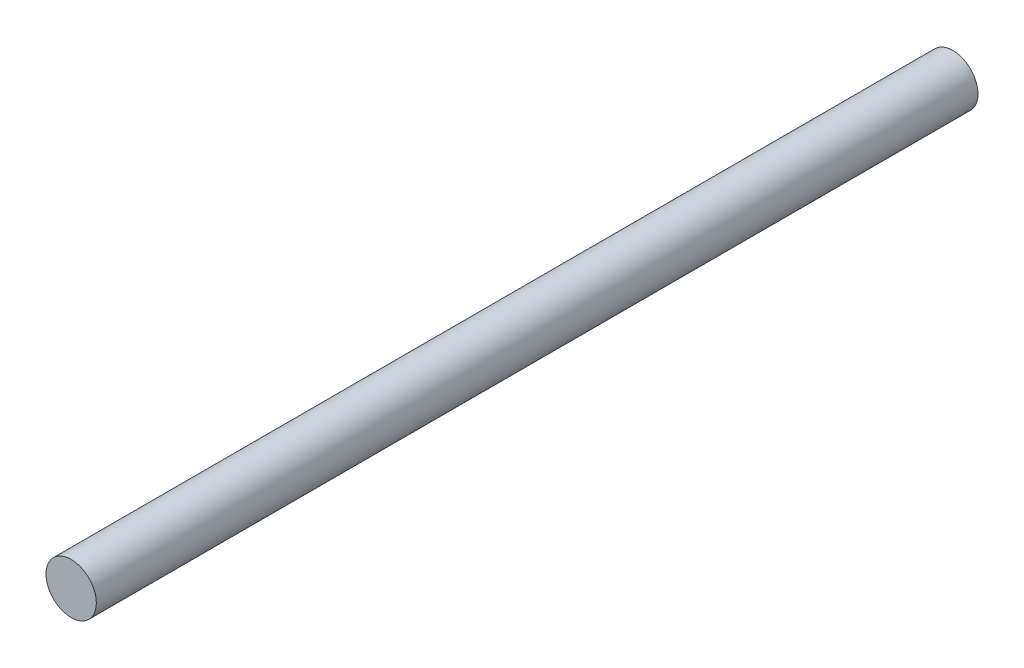
from build123d import *

# Parameters (mm, degrees)
SKETCH1_R           = 2
BOSS_EXTRUDE1_DEPTH = 70


with BuildPart() as part:
    # Sketch1 → Boss-Extrude1 (new body)
    with BuildSketch(Plane.XY):
        Circle(SKETCH1_R)
    extrude(amount=BOSS_EXTRUDE1_DEPTH)


solid = part.part
